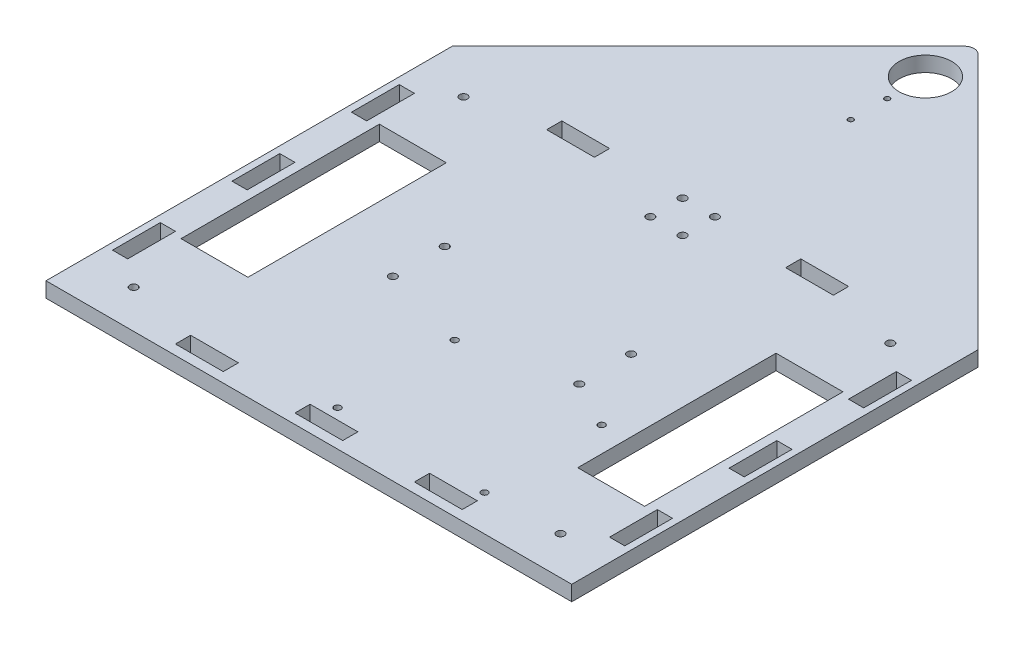
from build123d import *

# Parameters (mm, degrees)
SKETCH1_R           = 1.65
SKETCH1_R_2         = 1.1
SKETCH1_R_3         = 1.4
SKETCH1_R_4         = 11
SKETCH1_W           = 28
SKETCH1_H           = 83
SKETCH1_W_2         = 6.35
SKETCH1_H_2         = 20
SKETCH1_W_3         = 20
SKETCH1_H_3         = 6.35
BOSS_EXTRUDE1_DEPTH = 6.35


with BuildPart() as part:
    # Sketch1 → Boss-Extrude1 (new body)
    with BuildSketch(Plane(origin=(0, 0, 0), x_dir=(1, 0, 0), z_dir=(0, 1, 0))):
        with BuildLine():
            Line((-110, 85), (-2.828427125, 192.171572875))
            ThreePointArc((-2.828427125, 192.171572875), (0, 193.343145751), (2.828427125, 192.171572875))
            Line((2.828427125, 192.171572875), (110, 85))
            Line((110, 85), (110, -85))
            Line((110, -85), (-110, -85))
            Line((-110, -85), (-110, 85))
        make_face()
        with Locations(Location((-39, 10.85, 0), (0, 0, 270))):
            Circle(SKETCH1_R, mode=Mode.SUBTRACT)
        with Locations(Location((-39, -10.85, 0), (0, 0, 90))):
            Circle(SKETCH1_R, mode=Mode.SUBTRACT)
        with Locations(Location((-89.294117647, -69, 0), (0, 0, 270))):
            Circle(SKETCH1_R, mode=Mode.SUBTRACT)
        with Locations(Location((89.294117647, -69, 0), (0, 0, 90))):
            Circle(SKETCH1_R, mode=Mode.SUBTRACT)
        with Locations(Location((-89.294117647, 69, 0), (0, 0, 90))):
            Circle(SKETCH1_R, mode=Mode.SUBTRACT)
        with Locations(Location((89.294117647, 69, 0), (0, 0, 270))):
            Circle(SKETCH1_R, mode=Mode.SUBTRACT)
        with Locations(Location((39, -10.85, 0), (0, 0, 270))):
            Circle(SKETCH1_R, mode=Mode.SUBTRACT)
        with Locations(Location((39, 10.85, 0), (0, 0, 90))):
            Circle(SKETCH1_R, mode=Mode.SUBTRACT)
        with Locations(Location((0, 157, 0), (0, 0, 270))):
            Circle(SKETCH1_R_2, mode=Mode.SUBTRACT)
        with Locations(Location((0, 141.75, 0), (0, 0, 270))):
            Circle(SKETCH1_R_2, mode=Mode.SUBTRACT)
        with Locations(Location((-3, -21, 0), (0, 0, 270))):
            Circle(SKETCH1_R_3, mode=Mode.SUBTRACT)
        with Locations(Location((-3, -70, 0), (0, 0, 270))):
            Circle(SKETCH1_R_3, mode=Mode.SUBTRACT)
        with Locations(Location((58.5, -70, 0), (0, 0, 270))):
            Circle(SKETCH1_R_3, mode=Mode.SUBTRACT)
        with Locations(Location((58.5, -21, 0), (0, 0, 270))):
            Circle(SKETCH1_R_3, mode=Mode.SUBTRACT)
        with Locations(Location((-6.75, 78.125, 0), (0, 0, 270))):
            Circle(SKETCH1_R, mode=Mode.SUBTRACT)
        with Locations(Location((6.75, 78.125, 0), (0, 0, 270))):
            Circle(SKETCH1_R, mode=Mode.SUBTRACT)
        with Locations(Location((6.75, 64.625, 0), (0, 0, 270))):
            Circle(SKETCH1_R, mode=Mode.SUBTRACT)
        with Locations(Location((-6.75, 64.625, 0), (0, 0, 270))):
            Circle(SKETCH1_R, mode=Mode.SUBTRACT)
        with Locations(Location((0, 173, 0), (0, 0, 270))):
            Circle(SKETCH1_R_4, mode=Mode.SUBTRACT)
        with Locations((-83, 0)):
            Rectangle(SKETCH1_W, SKETCH1_H, mode=Mode.SUBTRACT)
        with Locations((-104, 50)):
            Rectangle(SKETCH1_W_2, SKETCH1_H_2, mode=Mode.SUBTRACT)
        with Locations((-104, 0)):
            Rectangle(SKETCH1_W_2, SKETCH1_H_2, mode=Mode.SUBTRACT)
        with Locations((-104, -50)):
            Rectangle(SKETCH1_W_2, SKETCH1_H_2, mode=Mode.SUBTRACT)
        with Locations((50, -77.667136592)):
            Rectangle(SKETCH1_W_3, SKETCH1_H_3, mode=Mode.SUBTRACT)
        with Locations((0, -77.667136592)):
            Rectangle(SKETCH1_W_3, SKETCH1_H_3, mode=Mode.SUBTRACT)
        with Locations((-50, -77.667136592)):
            Rectangle(SKETCH1_W_3, SKETCH1_H_3, mode=Mode.SUBTRACT)
        with Locations((104, -50)):
            Rectangle(SKETCH1_W_2, SKETCH1_H_2, mode=Mode.SUBTRACT)
        with Locations((104, 50)):
            Rectangle(SKETCH1_W_2, SKETCH1_H_2, mode=Mode.SUBTRACT)
        with Locations((104, 0)):
            Rectangle(SKETCH1_W_2, SKETCH1_H_2, mode=Mode.SUBTRACT)
        with Locations((-50, 77.667136592)):
            Rectangle(SKETCH1_W_3, SKETCH1_H_3, mode=Mode.SUBTRACT)
        with Locations((50, 77.667136592)):
            Rectangle(SKETCH1_W_3, SKETCH1_H_3, mode=Mode.SUBTRACT)
        with Locations((83, 0)):
            Rectangle(SKETCH1_W, SKETCH1_H, mode=Mode.SUBTRACT)
    extrude(amount=BOSS_EXTRUDE1_DEPTH)


solid = part.part
